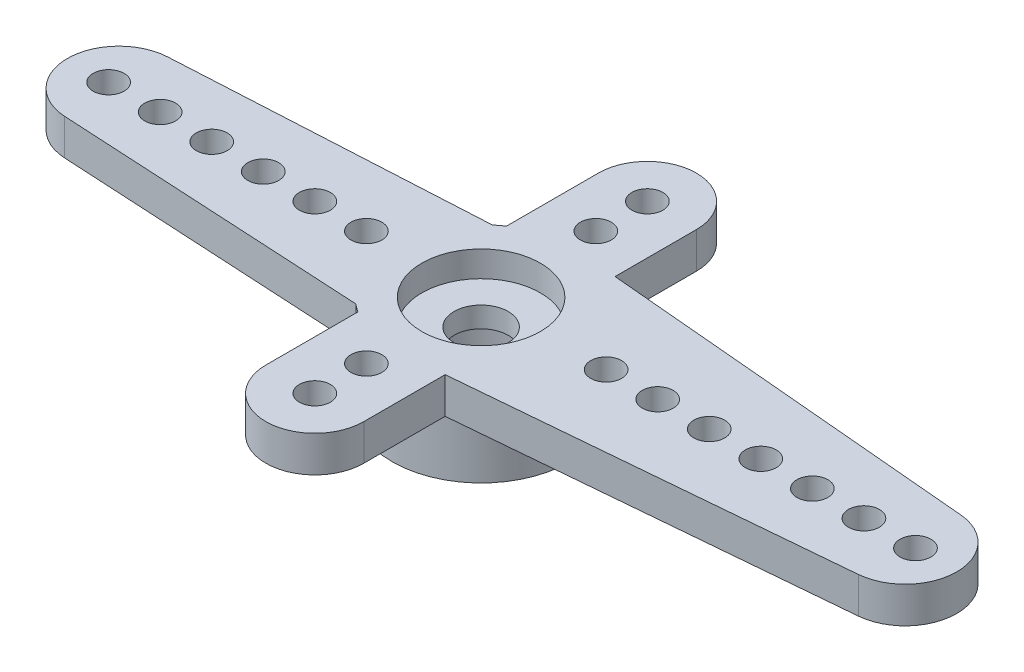
from build123d import *

# Parameters (mm, degrees)
RESSALTO_EXTRUS_O1_DEPTH = 1.4
ESBO_O2_R                = 3.45
RESSALTO_EXTRUS_O2_DEPTH = 2.4
FURO1_D                  = 1.2
PADR_O_LINEAR1_COUNT     = 6
PADR_O_LINEAR1_PITCH     = 2
RESSALTO_EXTRUS_O3_DEPTH = 1.4
FURO2_D                  = 1.2
PADR_O_LINEAR2_COUNT     = 7
PADR_O_LINEAR2_PITCH     = 2
RESSALTO_EXTRUS_O4_DEPTH = 1.4
FURO3_D                  = 1.2
PADR_O_LINEAR3_COUNT     = 2
PADR_O_LINEAR3_PITCH     = 2
PADR_OCIRCULAR1_COUNT    = 2
PADR_OCIRCULAR1_COPY_1_D = 1.2
FURO4_D                  = 5
FURO4_DEPTH              = 2
FURO5_D                  = 4.6
FURO5_DEPTH              = 1
FURO6_D                  = 2.1


with BuildPart() as part:
    # Esboço1 → Ressalto-extrusão1 (new body)
    with BuildSketch(Plane(origin=(0, 0, 0), x_dir=(1, 0, 0), z_dir=(0, 1, 0))):
        with BuildLine():
            Line((-14.159121967, 1.99702088), (-2.209072203, 2.65))
            ThreePointArc((-2.209072203, 2.65), (3.45, 0), (-2.209072203, -2.65))
            Line((-2.209072203, -2.65), (-14.159121967, -1.99702088))
            ThreePointArc((-14.159121967, -1.99702088), (-16.05, 0), (-14.159121967, 1.99702088))
        make_face()
    extrude(amount=-RESSALTO_EXTRUS_O1_DEPTH)

    # Esboço2 → Ressalto-extrusão2 (add)
    with BuildSketch(Plane.XZ.offset(1.4)):
        with Locations(Location((0, 0, 0), (0, 0, 90))):
            Circle(ESBO_O2_R)
    extrude(amount=RESSALTO_EXTRUS_O2_DEPTH)

    # Furo1 (through all)
    with Locations(Plane(origin=(0, 0, 0), x_dir=(1, 0, 0), z_dir=(0, 1, 0))):
        with Locations((-14.45, 0)):
            furo1 = Hole(FURO1_D / 2)

    # Padrão linear1: Furo1 ×6
    with Locations(*[(i * PADR_O_LINEAR1_PITCH, 0, 0) for i in range(1, PADR_O_LINEAR1_COUNT)]):
        add(furo1, mode=Mode.SUBTRACT)

    # Esboço12 → Ressalto-extrusão3 (add)
    with BuildSketch(Plane(origin=(0, 0, 0), x_dir=(1, 0, 0), z_dir=(0, 1, 0))):
        with BuildLine():
            Line((0.304103343, 3.436571134), (16.626291793, 1.99221515))
            ThreePointArc((16.626291793, 1.99221515), (18.45, 0), (16.626291793, -1.99221515))
            Line((16.626291793, -1.99221515), (0.304103343, -3.436571134))
            ThreePointArc((0.304103343, -3.436571134), (3.45, 0), (0.304103343, 3.436571134))
        make_face()
    extrude(amount=-RESSALTO_EXTRUS_O3_DEPTH)

    # Furo2 (through all)
    with Locations(Plane(origin=(0, 0, 0), x_dir=(1, 0, 0), z_dir=(0, 1, 0))):
        with Locations((16.85, 0)):
            furo2 = Hole(FURO2_D / 2)

    # Padrão linear2: Furo2 ×7
    with Locations(*[(-i * PADR_O_LINEAR2_PITCH, 0, 0) for i in range(1, PADR_O_LINEAR2_COUNT)]):
        add(furo2, mode=Mode.SUBTRACT)

    # Esboço16 → Ressalto-extrusão4 (add)
    with BuildSketch(Plane(origin=(0, 0, 0), x_dir=(1, 0, 0), z_dir=(0, 1, 0))):
        with BuildLine():
            Line((-1.9, -6.45), (-1.9, 6.45))
            ThreePointArc((-1.9, 6.45), (0, 8.35), (1.9, 6.45))
            Line((1.9, 6.45), (1.9, -6.45))
            ThreePointArc((1.9, -6.45), (0, -8.35), (-1.9, -6.45))
        make_face()
    extrude(amount=-RESSALTO_EXTRUS_O4_DEPTH)

    # Furo3 (through all)
    with Locations(Plane(origin=(0, 0, 0), x_dir=(1, 0, 0), z_dir=(0, 1, 0))):
        with Locations((0, -6.45)):
            furo3 = Hole(FURO3_D / 2)

    # Padrão linear3: Furo3 ×2
    with Locations(*[(0, 0, -i * PADR_O_LINEAR3_PITCH) for i in range(1, PADR_O_LINEAR3_COUNT)]):
        add(furo3, mode=Mode.SUBTRACT)

    # PadrãoCircular1: Furo3 ×2 about axis
    padr_ocircular1_axis = Axis((0, 0, 0), (0, 1, 0))
    for i in range(1, PADR_OCIRCULAR1_COUNT):
        add(furo3.rotate(padr_ocircular1_axis, i * 360 / PADR_OCIRCULAR1_COUNT), mode=Mode.SUBTRACT)

    # PadrãoCircular1 copy 1 (through all)
    with Locations(Plane(origin=(0, 0, 2), x_dir=(-1, 0, 0), z_dir=(0, 1, 0))):
        with Locations((0, -6.45)):
            Hole(PADR_OCIRCULAR1_COPY_1_D / 2)

    # Furo4
    with Locations(Plane(origin=(0, -3.8, 0), x_dir=(-1, 0, 0), z_dir=(0, -1, 0))):
        with Locations((0, 0)):
            Hole(FURO4_D / 2, depth=FURO4_DEPTH)

    # Furo5
    with Locations(Plane(origin=(0, 0, 0), x_dir=(1, 0, 0), z_dir=(0, 1, 0))):
        with Locations((0, 0)):
            Hole(FURO5_D / 2, depth=FURO5_DEPTH)

    # Furo6 (through all)
    with Locations(Plane(origin=(0, 0, 0), x_dir=(1, 0, 0), z_dir=(0, 1, 0))):
        with Locations((0, 0)):
            Hole(FURO6_D / 2)


solid = part.part
